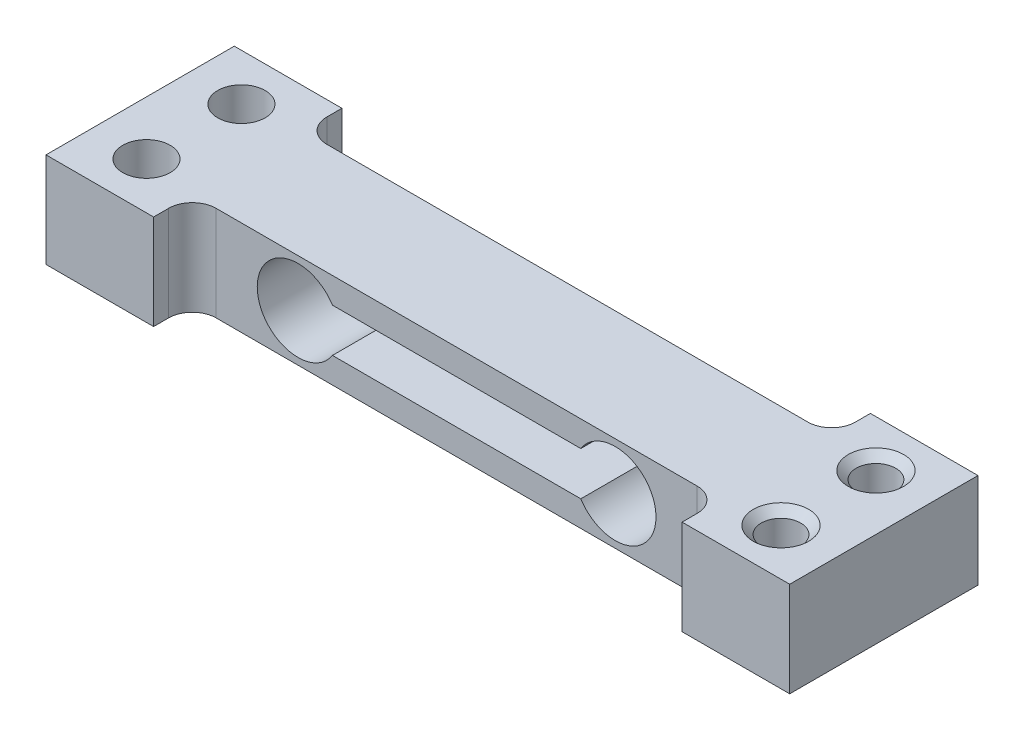
from build123d import *

# Parameters (mm, degrees)
BOSS_EXTRUDE1_DEPTH        = 3
CUT_EXTRUDE1_DEPTH         = 26.505930683
M3_TAPPED_HOLE1_AT_2_COUNT = 2
M3_TAPPED_HOLE1_AT_2_PITCH = 6
SKETCH6_R                  = 1.5
CUT_EXTRUDE2_DEPTH         = 25.973035458


with BuildPart() as part:
    # Sketch1 → Boss-Extrude1 (new, symmetric)
    with BuildSketch(Plane(origin=(0, 0, 0), x_dir=(1, 0, 0), z_dir=(0, 1, 0))):
        with BuildLine():
            Line((0, -3.5), (0, 3.5))
            Line((0, 3.5), (15.2, 3.5))
            ThreePointArc((15.2, 3.5), (16.260660172, 3.939339828), (16.7, 5))
            Line((16.7, 5), (16.7, 5.95))
            Line((16.7, 5.95), (23.5, 5.95))
            Line((23.5, 5.95), (23.5, -5.95))
            Line((23.5, -5.95), (16.7, -5.95))
            Line((16.7, -5.95), (16.7, -5))
            ThreePointArc((16.7, -5), (16.260660172, -3.939339828), (15.2, -3.5))
            Line((15.2, -3.5), (0, -3.5))
        make_face()
    extrude(amount=BOSS_EXTRUDE1_DEPTH, both=True)

    # Sketch2 → Cut-Extrude1 (cut, through all)
    with BuildSketch(Plane.XY.offset(3.5)):
        with BuildLine():
            ThreePointArc((7.847845894, 1.375), (7.45, 0), (7.847845894, -1.375))
            Line((7.847845894, -1.375), (10.025, -1.375))
            Line((10.025, -1.375), (10.025, 1.375))
            Line((10.025, 1.375), (7.847845894, 1.375))
        make_face()
        with BuildLine():
            Line((10.025, -1.375), (7.847845894, -1.375))
            ThreePointArc((7.847845894, -1.375), (10.740700069, -2.473539652), (12.6, 0))
            ThreePointArc((12.6, 0), (10.740700069, 2.473539652), (7.847845894, 1.375))
            Line((7.847845894, 1.375), (10.025, 1.375))
            Line((10.025, 1.375), (10.025, -1.375))
        make_face()
        with BuildLine():
            Line((0, 1.375), (0, -1.375))
            Line((0, -1.375), (7.847845894, -1.375))
            ThreePointArc((7.847845894, -1.375), (7.45, 0), (7.847845894, 1.375))
            Line((7.847845894, 1.375), (0, 1.375))
        make_face()
    extrude(amount=-CUT_EXTRUDE1_DEPTH, mode=Mode.SUBTRACT)

    # Mirror1: part across plane


with BuildPart() as part_1:
    add(part.part)
    add(part.part.mirror(Plane(origin=(0, 0, 0), x_dir=(0, 0, 1), z_dir=(1, 0, 0))))

    # Sketch5 → M3 Tapped Hole1 (revolve, cut)
    with BuildSketch(Plane(origin=(20, 3, -3), x_dir=(0, 0, 1), z_dir=(1, 0, 0))):
        Polygon((0, 0), (0, 6), (1.75, 6), (1.25, 5.5), (1.25, 0.5), (1.75, 0), align=None)
    m3_tapped_hole1 = revolve(axis=Axis((20, 9.35, -3), (0, -1, 0)), mode=Mode.SUBTRACT)

    # M3 Tapped Hole1 at 2: M3 Tapped Hole1 ×2
    with Locations(*[(0, 0, i * M3_TAPPED_HOLE1_AT_2_PITCH) for i in range(1, M3_TAPPED_HOLE1_AT_2_COUNT)]):
        add(m3_tapped_hole1, mode=Mode.SUBTRACT)

    # Sketch6 → Cut-Extrude2 (cut, through all)
    with BuildSketch(Plane(origin=(0, 3, 0), x_dir=(1, 0, 0), z_dir=(0, 1, 0))):
        with Locations(Location((-20.1, 3, 0), (0, 0, 270))):
            Circle(SKETCH6_R)
        with Locations(Location((-20.1, -3, 0), (0, 0, 270))):
            Circle(SKETCH6_R)
    extrude(amount=-CUT_EXTRUDE2_DEPTH, mode=Mode.SUBTRACT)


solid = part_1.part
